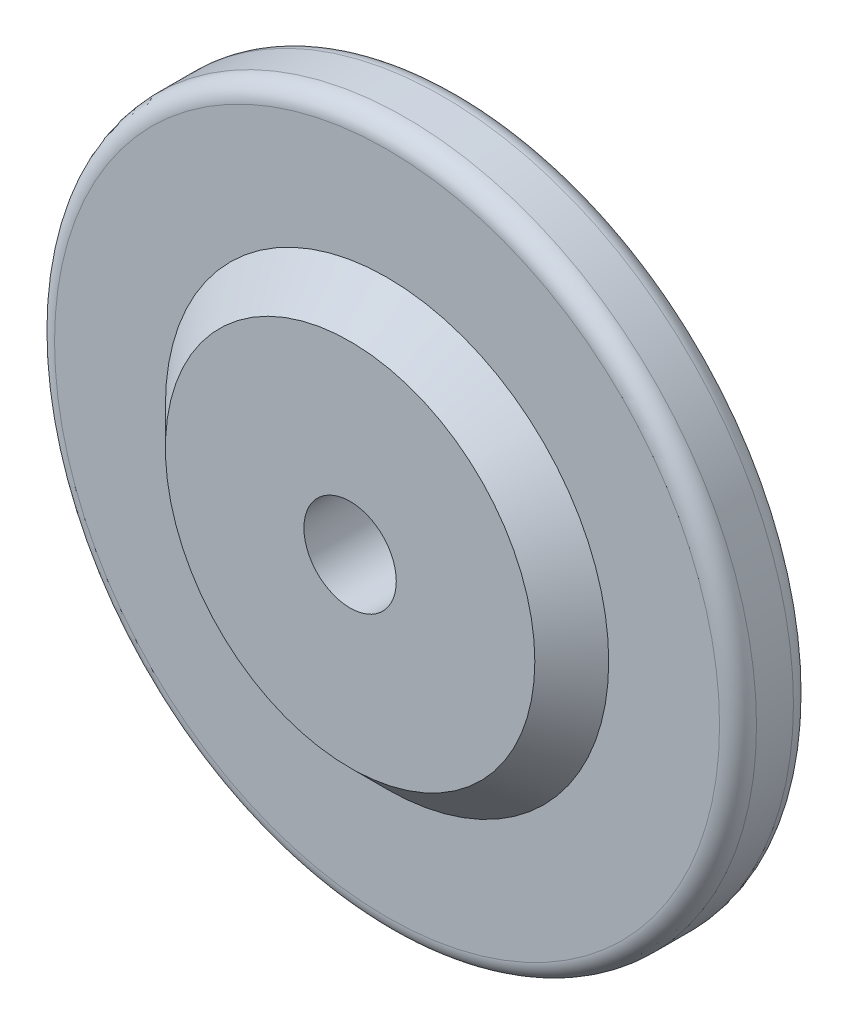
from build123d import *

# Parameters (mm, degrees)
SKETCH1_R           = 9.5
SKETCH1_R_2         = 6
SKETCH1_R_3         = 1.25
BOSS_EXTRUDE1_DEPTH = 2
BOSS_EXTRUDE2_START = 2
SKETCH1_3_R         = 6
BOSS_EXTRUDE2_DEPTH = 1
BOSS_EXTRUDE2_TAPER = 45
SKETCH2_R           = 8.5
CUT_EXTRUDE1_DEPTH  = 0.25
CUT_EXTRUDE1_DRAFT  = -84
SKETCH1_4_R         = 1.25
CUT_EXTRUDE2_DEPTH  = 40.25
FILLET1_R           = 0.5


with BuildPart() as part:
    # Sketch1 → Boss-Extrude1 (new body)
    # profile 1 of 2: a face of its own
    with BuildSketch(Plane.XY):
        Circle(SKETCH1_R)
        Circle(SKETCH1_R_2, mode=Mode.SUBTRACT)
    # profile 2 of 2: a face of its own
    with BuildSketch(Plane.XY):
        Circle(SKETCH1_R_2)
        Circle(SKETCH1_R_3, mode=Mode.SUBTRACT)
    extrude(amount=BOSS_EXTRUDE1_DEPTH)

    # Sketch1<3> → Boss-Extrude2 (add)
    with BuildSketch(Plane.XY.offset(BOSS_EXTRUDE2_START)):
        Circle(SKETCH1_3_R)
    extrude(amount=BOSS_EXTRUDE2_DEPTH, taper=BOSS_EXTRUDE2_TAPER)


with BuildPart() as cut_extrude1_tool:
    # Sketch2 → Cut-Extrude1 (with draft: the straight prism first)
    with BuildSketch(Plane(origin=(0, 0, 0), x_dir=(-1, 0, 0), z_dir=(0, 0, -1))):
        Circle(SKETCH2_R)
    extrude(amount=-CUT_EXTRUDE1_DEPTH)
    # Cut-Extrude1: the draft: its side faces are tilted about the plane it starts from
    cut_extrude1_sides = [cut_extrude1_tool.faces().sort_by_distance(p)[0] for p in [
        (8.5, 0, 0.125),
    ]]
    draft(cut_extrude1_sides, Plane(origin=(0, 0, 0), x_dir=(-1, 0, 0), z_dir=(0, 0, -1)), CUT_EXTRUDE1_DRAFT)


with BuildPart() as part_1:
    add(part.part)

    # Cut-Extrude1: cut by cut_extrude1_tool
    add(cut_extrude1_tool.part, mode=Mode.SUBTRACT)

    # Sketch1<4> → Cut-Extrude2 (cut)
    with BuildSketch(Plane.XY):
        with Locations(Location((0, 0, 0), (0, 0, 180))):
            Circle(SKETCH1_4_R)
    extrude(amount=CUT_EXTRUDE2_DEPTH, mode=Mode.SUBTRACT)

    # Fillet1
    fillet1_edges = [part_1.edges().sort_by_distance(p)[0] for p in [
        (-9.5, 0, 0),
        (-9.5, 0, 2),
    ]]
    fillet(fillet1_edges, radius=FILLET1_R)


solid = part_1.part
